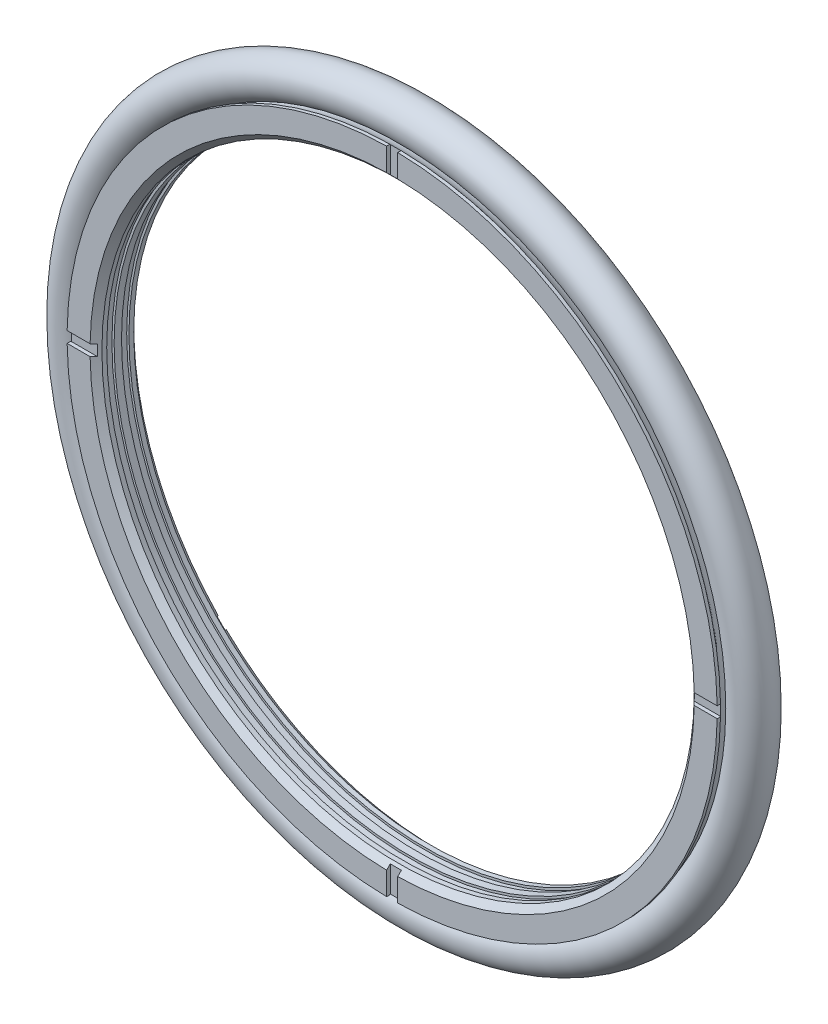
from build123d import *

# Parameters (mm, degrees)
SKETCH4_W          = 1.5
SKETCH4_H          = 16.449772914
CUT_EXTRUDE1_DEPTH = 0.5
CUT_EXTRUDE2_DEPTH = 0.5
CIRPATTERN1_COUNT  = 4
SKETCH2_R          = 2.65


with BuildPart() as part:
    # Sketch1 → Revolve1 (revolve)
    with BuildSketch(Plane(origin=(0, 0, 0), x_dir=(0, 0, -1), z_dir=(1, 0, 0)), mode=Mode.PRIVATE) as revolve1_sk:
        with BuildLine():
            Line((-2.15, 40), (-1.5, 40))
            Line((-1.5, 40), (-1.5, 40.3))
            Line((-1.5, 40.3), (-0.5, 40.3))
            Line((-0.5, 40.3), (-0.5, 40))
            Line((-0.5, 40), (0.5, 40))
            Line((0.5, 40), (0.5, 40.3))
            Line((0.5, 40.3), (1.5, 40.3))
            Line((1.5, 40.3), (1.5, 40))
            Line((1.5, 40), (2.15, 40))
            Line((2.15, 40), (2.95, 40.8))
            Line((2.95, 40.8), (2.95, 43.9))
            Line((2.95, 43.9), (2.5, 43.9))
            ThreePointArc((2.5, 43.9), (0, 42.603720497), (-2.5, 43.9))
            Line((-2.5, 43.9), (-2.95, 43.9))
            Line((-2.95, 43.9), (-2.95, 40.8))
            Line((-2.95, 40.8), (-2.15, 40))
        make_face()
    revolve(revolve1_sk.sketch.rotate(Axis((0, 0, 0), (0, 0, -1)), 90), axis=Axis((0, 0, 0), (0, 0, -1)))

    # Sketch4 → Cut-Extrude1 (cut)
    with BuildSketch(Plane.XY.offset(2.95)):
        with Locations((0, 42.20188555)):
            Rectangle(SKETCH4_W, SKETCH4_H)
    cut_extrude1 = extrude(amount=-CUT_EXTRUDE1_DEPTH, mode=Mode.SUBTRACT)

    # Sketch5 → Cut-Extrude2 (cut)
    with BuildSketch(Plane(origin=(0, 0, -2.95), x_dir=(-1, 0, 0), z_dir=(0, 0, -1))):
        Polygon((33.603985041, 32.543324869), (32.543324869, 33.603985041), (24.925514037, 25.986174209), (25.986174209, 24.925514037), align=None)
    cut_extrude2 = extrude(amount=-CUT_EXTRUDE2_DEPTH, mode=Mode.SUBTRACT)

    # CirPattern1: Cut-Extrude1, Cut-Extrude2 ×4 about axis
    cirpattern1_axis = Axis((0, 0, 0), (0, 0, 1))
    add([cut_extrude1.rotate(cirpattern1_axis, i * 360 / CIRPATTERN1_COUNT) for i in range(1, CIRPATTERN1_COUNT)], mode=Mode.SUBTRACT)
    add([cut_extrude2.rotate(cirpattern1_axis, i * 360 / CIRPATTERN1_COUNT) for i in range(1, CIRPATTERN1_COUNT)], mode=Mode.SUBTRACT)


with BuildPart() as body_2:
    # Sketch2 → Revolve2 (revolve)
    with BuildSketch(Plane(origin=(0, 0, 0), x_dir=(0, 0, -1), z_dir=(1, 0, 0)), mode=Mode.PRIVATE) as revolve2_sk:
        with Locations((0, 45.85)):
            Circle(SKETCH2_R)
    revolve(revolve2_sk.sketch.rotate(Axis((0, 0, 0), (0, 0, -1)), 226.066360187), axis=Axis((0, 0, 0), (0, 0, -1)))


solid = Compound([part.part, body_2.part])
